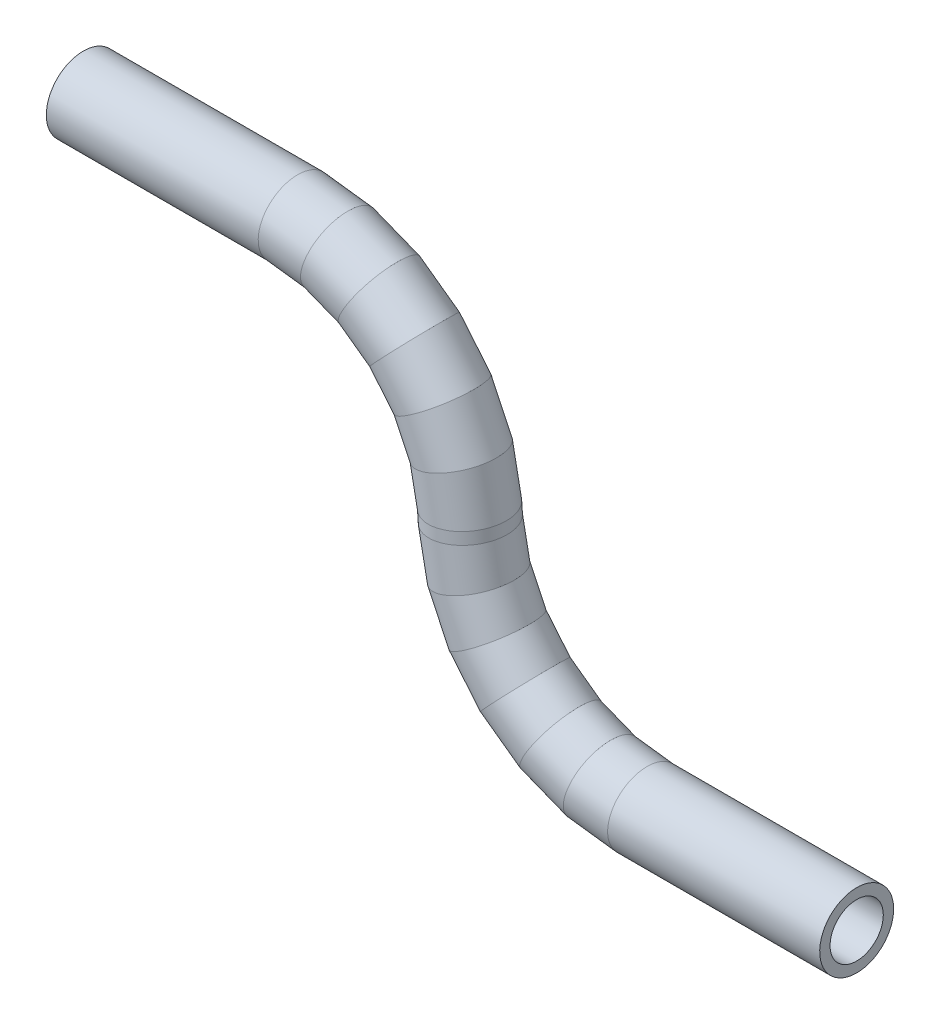
from build123d import *

# Parameters (mm, degrees)
PROFILE_R   = 3.175
PROFILE_R_2 = 2.286


with BuildPart() as part:
    # Tube: sweep along a curve in space
    with BuildLine() as tube_path:
        Line((-2080.987960479, 33, 0), (-2099.187960479, 33, 0))
        Line((-2099.187960479, 33, 0), (-2102.909081944, 33.468886655, 0))
        Line((-2102.909081944, 33.468886655, 0), (-2106.397565517, 34.846232661, 0))
        Line((-2106.397565517, 34.846232661, 0), (-2109.435317411, 37.045928797, 0))
        Line((-2109.435317411, 37.045928797, 0), (-2111.832422782, 39.930453974, 0))
        Line((-2111.832422782, 39.930453974, 0), (-2113.439018869, 43.31947281, 0))
        Line((-2113.439018869, 43.31947281, 0), (-2114.154664142, 47.001109878, 0))
        Line((-2114.154664142, 47.001109878, 0), (-2114.221256816, 47.998890122, 0))
        Line((-2114.221256816, 47.998890122, 0), (-2114.936902089, 51.68052719, 0))
        Line((-2114.936902089, 51.68052719, 0), (-2116.543498176, 55.069546026, 0))
        Line((-2116.543498176, 55.069546026, 0), (-2118.940603547, 57.954071203, 0))
        Line((-2118.940603547, 57.954071203, 0), (-2121.978355441, 60.153767339, 0))
        Line((-2121.978355441, 60.153767339, 0), (-2125.466839013, 61.531113345, 0))
        Line((-2125.466839013, 61.531113345, 0), (-2129.187960479, 62, 0))
        Line((-2129.187960479, 62, 0), (-2147.387960479, 62, 0))
    # Profile → Tube (sweep)
    with BuildSketch(Plane(origin=(-2080.987960479, 0, 0), x_dir=(0, 0, -1), z_dir=(1, 0, 0))):
        with Locations((0, 33)):
            Circle(PROFILE_R)
        with Locations((0, 33)):
            Circle(PROFILE_R_2, mode=Mode.SUBTRACT)
    sweep(path=tube_path.line, transition=Transition.RIGHT)


solid = part.part
